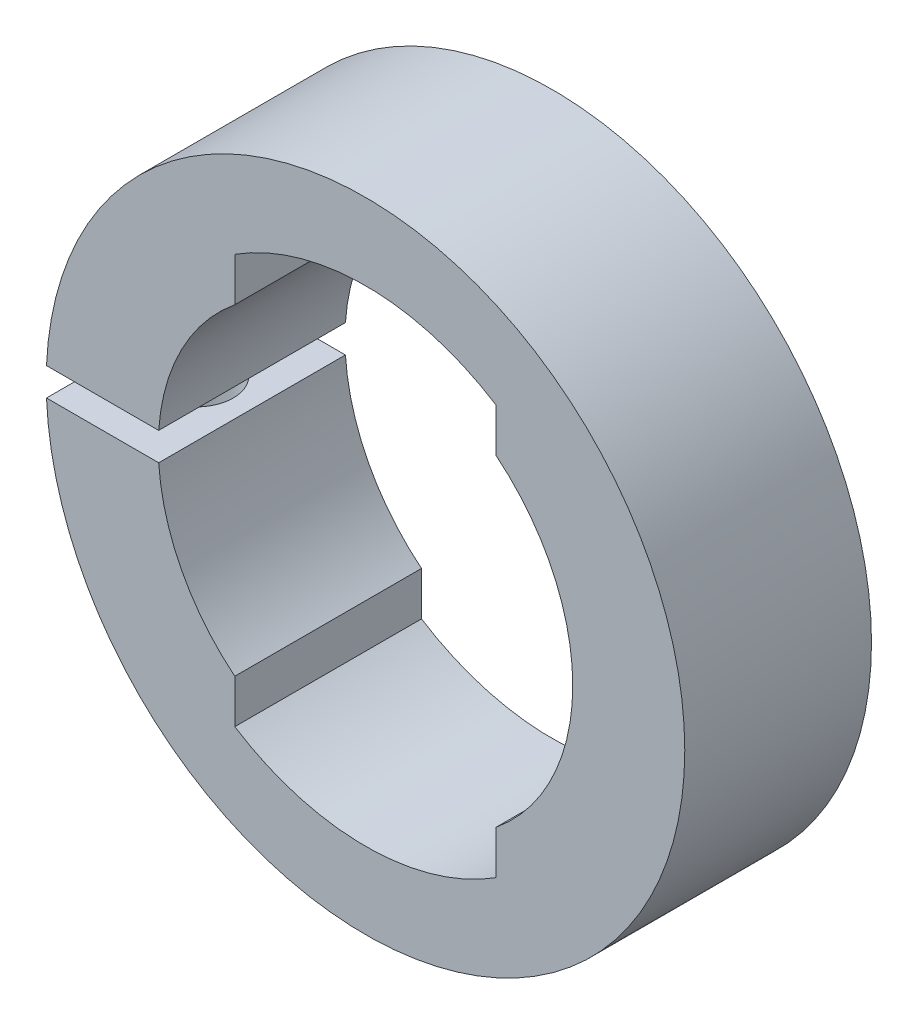
from build123d import *

# Parameters (mm, degrees)
BOSS_EXTRUDE1_DEPTH     = 10
CUT_EXTRUDE1_DEPTH      = 27.665192668
CUT_EXTRUDE1_DEPTH_BACK = 27.665192668
SKETCH2_R               = 2


with BuildPart() as part:
    # Sketch1 → Boss-Extrude1 (new body)
    with BuildSketch(Plane.XY):
        with BuildLine():
            Line((-7, 10.95445115), (-7, 8.614522622))
            ThreePointArc((-7, 8.614522622), (-9.855748076, 5.106293163), (-11.074633177, 0.75))
            Line((-11.074633177, 0.75), (-17.083544714, 0.75))
            ThreePointArc((-17.083544714, 0.75), (17.1, 0), (-17.083544714, -0.75))
            Line((-17.083544714, -0.75), (-11.074633177, -0.75))
            ThreePointArc((-11.074633177, -0.75), (-9.855748076, -5.106293163), (-7, -8.614522622))
            Line((-7, -8.614522622), (-7, -10.95445115))
            ThreePointArc((-7, -10.95445115), (0, -13), (7, -10.95445115))
            Line((7, -10.95445115), (7, -8.614522622))
            ThreePointArc((7, -8.614522622), (11.1, 0), (7, 8.614522622))
            Line((7, 8.614522622), (7, 10.95445115))
            ThreePointArc((7, 10.95445115), (0, 13), (-7, 10.95445115))
        make_face()
    extrude(amount=BOSS_EXTRUDE1_DEPTH)

    # Sketch2 → Cut-Extrude1 (cut, two sides: drawn at the far end of the back side and taken through both)
    with BuildSketch(Plane(origin=(0, -0.75, 0), x_dir=(1, 0, 0), z_dir=(0, 1, 0)).offset(-CUT_EXTRUDE1_DEPTH_BACK)):
        with Locations(Location((-14.079088945, -5, 0), (0, 0, 270))):
            Circle(SKETCH2_R)
    extrude(amount=CUT_EXTRUDE1_DEPTH + CUT_EXTRUDE1_DEPTH_BACK, mode=Mode.SUBTRACT)


solid = part.part
